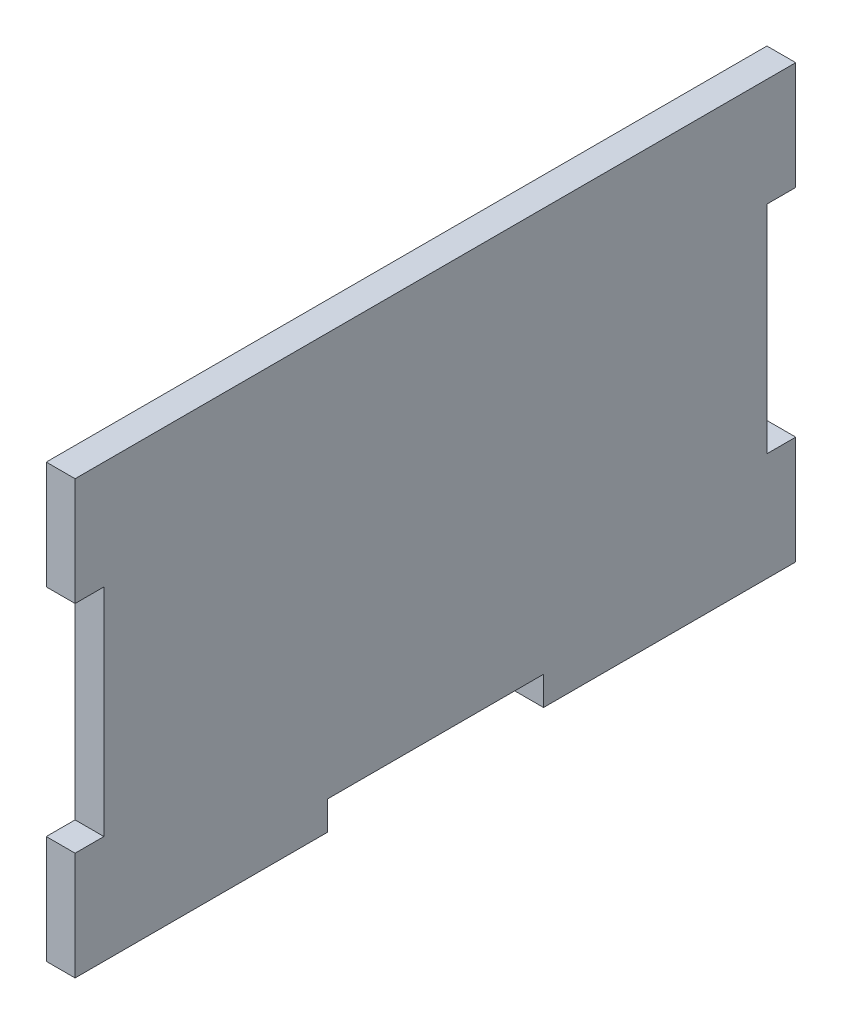
from build123d import *

# Parameters (mm, degrees)
ESQUISSE1_W             = 50
ESQUISSE1_H             = 30
BOSS_EXTRU_1_DEPTH      = 2
ESQUISSE2_W             = 2
ESQUISSE2_H             = 15
ENL_V_MAT_EXTRU_1_DEPTH = 2
ESQUISSE3_W             = 15.005230118
ESQUISSE3_H             = 2
ENL_V_MAT_EXTRU_2_DEPTH = 2


with BuildPart() as part:
    # Esquisse1 → Boss.-Extru.1 (new body)
    with BuildSketch(Plane(origin=(0, 0, 0), x_dir=(0, 0, -1), z_dir=(1, 0, 0))):
        with Locations((25, 15)):
            Rectangle(ESQUISSE1_W, ESQUISSE1_H)
    extrude(amount=BOSS_EXTRU_1_DEPTH)

    # Esquisse2 → Enlèv. mat.-Extru.1 (cut)
    with BuildSketch(Plane(origin=(2, 0, 0), x_dir=(0, 0, -1), z_dir=(1, 0, 0))):
        with Locations((1, 15)):
            Rectangle(ESQUISSE2_W, ESQUISSE2_H)
        with Locations((49, 15)):
            Rectangle(ESQUISSE2_W, ESQUISSE2_H)
    extrude(amount=-ENL_V_MAT_EXTRU_1_DEPTH, mode=Mode.SUBTRACT)

    # Esquisse3 → Enlèv. mat.-Extru.2 (cut)
    with BuildSketch(Plane(origin=(2, 0, 0), x_dir=(0, 0, -1), z_dir=(1, 0, 0))):
        with Locations((25, 1)):
            Rectangle(ESQUISSE3_W, ESQUISSE3_H)
    extrude(amount=-ENL_V_MAT_EXTRU_2_DEPTH, mode=Mode.SUBTRACT)


solid = part.part
